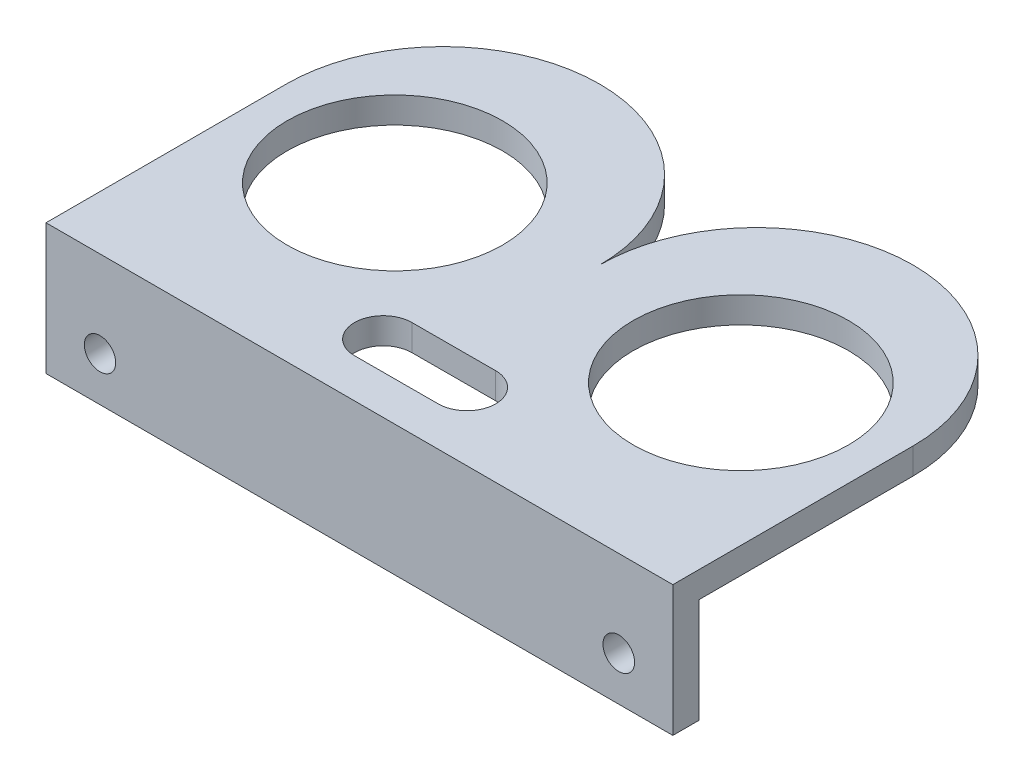
from build123d import *

# Parameters (mm, degrees)
SKETCH1_W               = 48
SKETCH1_H               = 10
BOSS_EXTRUDE5_DEPTH     = 2
BOSS_EXTRUDE6_START     = 5
BOSS_EXTRUDE6_DEPTH     = 2
SKETCH3_R               = 8.25
CUT_EXTRUDE1_DEPTH      = 2
CUT_EXTRUDE2_DEPTH      = 40.051403925
CUT_EXTRUDE2_DEPTH_BACK = 40.051403925
CUT_EXTRUDE3_DEPTH      = 40.051403925
CUT_EXTRUDE3_DEPTH_BACK = 10
SKETCH6_R               = 1.2
SKETCH6_R_2             = 1.211894006


with BuildPart() as part:
    # Sketch1 → Boss-Extrude5 (new body)
    with BuildSketch(Plane.XY):
        Rectangle(SKETCH1_W, SKETCH1_H)
    extrude(amount=-BOSS_EXTRUDE5_DEPTH)

    # Sketch2 → Boss-Extrude6 (add)
    with BuildSketch(Plane(origin=(0, 0, 0), x_dir=(1, 0, 0), z_dir=(0, 1, 0)).offset(BOSS_EXTRUDE6_START)):
        with BuildLine():
            ThreePointArc((-1.241034606, 23.712139016), (-12, 30.397568135), (-22.758965394, 23.712139016))
            Line((-22.758965394, 23.712139016), (-1.241034606, 23.712139016))
        make_face()
        with BuildLine():
            Line((-1.241034606, 23.712139016), (-22.758965394, 23.712139016))
            ThreePointArc((-22.758965394, 23.712139016), (-23.685623319, 21.126342152), (-24, 18.397568135))
            ThreePointArc((-24, 18.397568135), (-12, 6.397568135), (0, 18.397568135))
            ThreePointArc((0, 18.397568135), (-0.314376681, 21.126342152), (-1.241034606, 23.712139016))
        make_face()
        with BuildLine():
            ThreePointArc((22.758965394, 23.712139016), (12, 30.397568135), (1.241034606, 23.712139016))
            Line((1.241034606, 23.712139016), (22.758965394, 23.712139016))
        make_face()
        with BuildLine():
            Line((22.758965394, 23.712139016), (1.241034606, 23.712139016))
            ThreePointArc((1.241034606, 23.712139016), (0.314376681, 21.126342152), (0, 18.397568135))
            ThreePointArc((0, 18.397568135), (12, 6.397568135), (24, 18.397568135))
            ThreePointArc((24, 18.397568135), (23.685623319, 21.126342152), (22.758965394, 23.712139016))
        make_face()
        with BuildLine():
            ThreePointArc((0, 18.397568135), (-12, 6.397568135), (-24, 18.397568135))
            Line((-24, 18.397568135), (-24, 2))
            Line((-24, 2), (24, 2))
            Line((24, 2), (24, 18.397568135))
            ThreePointArc((24, 18.397568135), (12, 6.397568135), (0, 18.397568135))
        make_face()
    extrude(amount=-BOSS_EXTRUDE6_DEPTH)

    # Sketch3 → Cut-Extrude1 (cut)
    with BuildSketch(Plane(origin=(0, 5, 0), x_dir=(1, 0, 0), z_dir=(0, 1, 0))):
        with Locations(Location((-13.286531406, 15.996474508, 0), (0, 0, 270))):
            Circle(SKETCH3_R)
        with Locations(Location((13.213468594, 15.996474508, 0), (0, 0, 270))):
            Circle(SKETCH3_R)
    extrude(amount=-CUT_EXTRUDE1_DEPTH, mode=Mode.SUBTRACT)

    # Sketch5 → Cut-Extrude2 (cut, two sides: drawn at the far end of the back side and taken through both)
    with BuildSketch(Plane(origin=(0, 0, 0), x_dir=(1, 0, 0), z_dir=(0, 1, 0)).offset(-CUT_EXTRUDE2_DEPTH_BACK)):
        with BuildLine():
            Line((-3.373580641, 7.393929887), (3.026393541, 7.406054321))
            ThreePointArc((3.026393541, 7.406054321), (5.230557377, 5.210226053), (3.034729108, 3.006062217))
            Line((3.034729108, 3.006062217), (-3.365245074, 2.993937783))
            ThreePointArc((-3.365245074, 2.993937783), (-5.56940891, 5.189766052), (-3.373580641, 7.393929887))
        make_face()
    extrude(amount=CUT_EXTRUDE2_DEPTH + CUT_EXTRUDE2_DEPTH_BACK, mode=Mode.SUBTRACT)

    # Sketch6 → Cut-Extrude3 (cut, two sides: drawn at the far end of the back side and taken through both)
    with BuildSketch(Plane.XY.offset(-CUT_EXTRUDE3_DEPTH_BACK)):
        with Locations(Location((-19.864598195, -1.616601086, 0), (0, 0, 180))):
            Circle(SKETCH6_R)
        with Locations(Location((19.86, -1.616601086, 0), (0, 0, 180))):
            Circle(SKETCH6_R_2)
    extrude(amount=CUT_EXTRUDE3_DEPTH + CUT_EXTRUDE3_DEPTH_BACK, mode=Mode.SUBTRACT)


solid = part.part
